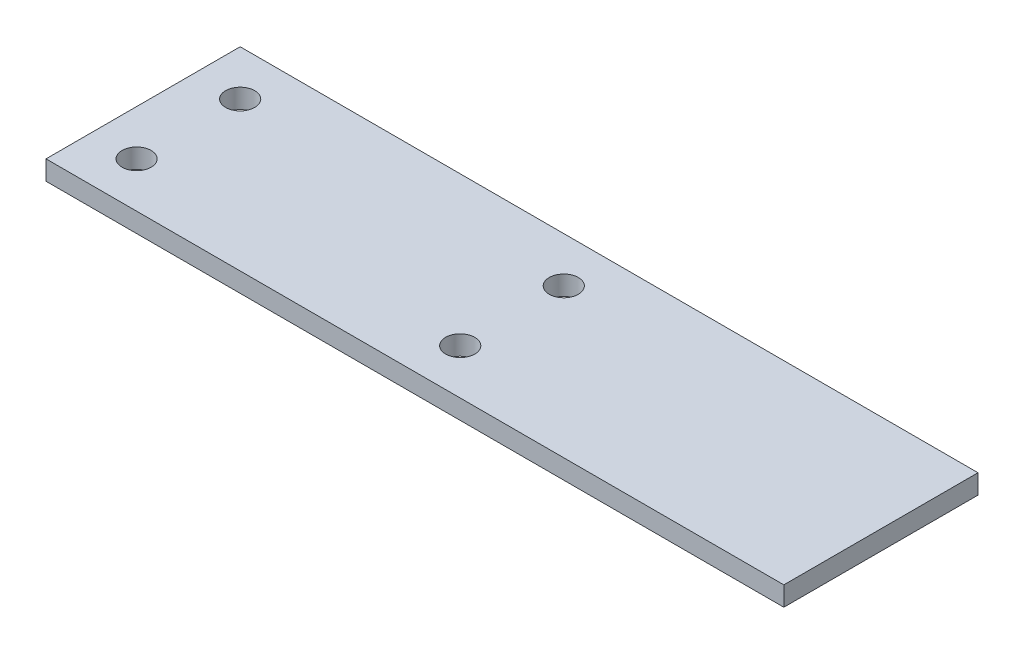
from build123d import *

# Parameters (mm, degrees)
SKETCH1_R           = 2.25
BOSS_EXTRUDE1_DEPTH = 3


with BuildPart() as part:
    # Sketch1 → Boss-Extrude1 (new body)
    with BuildSketch(Plane(origin=(0, 0, 0), x_dir=(1, 0, 0), z_dir=(0, 1, 0))):
        Polygon((-7, 23), (-7, -7), (57, -7), (107, -7), (107, 23), (57, 23), align=None)
        with Locations(Location((0, 0, 0), (0, 0, 270))):
            Circle(SKETCH1_R, mode=Mode.SUBTRACT)
        with Locations(Location((0, 16, 0), (0, 0, 270))):
            Circle(SKETCH1_R, mode=Mode.SUBTRACT)
        with Locations(Location((50, 0, 0), (0, 0, 270))):
            Circle(SKETCH1_R, mode=Mode.SUBTRACT)
        with Locations(Location((50, 16, 0), (0, 0, 270))):
            Circle(SKETCH1_R, mode=Mode.SUBTRACT)
    extrude(amount=BOSS_EXTRUDE1_DEPTH)


solid = part.part
